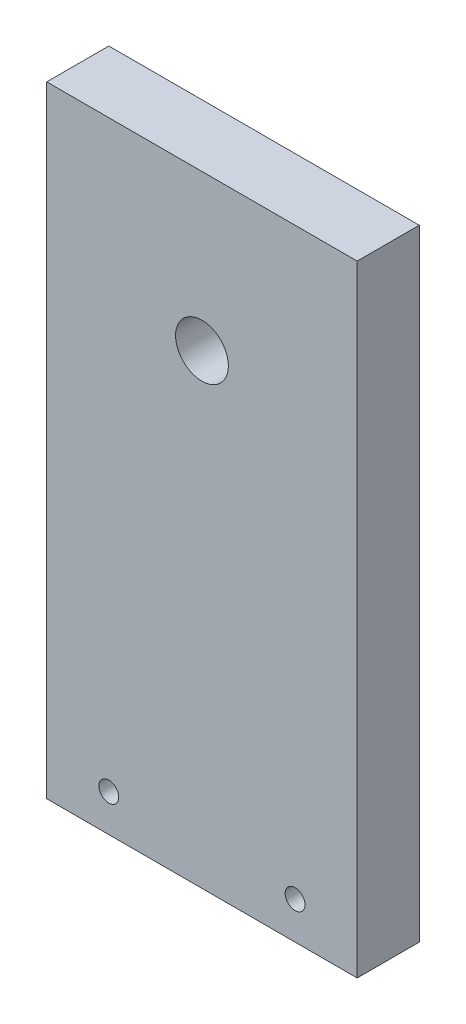
from build123d import *

# Parameters (mm, degrees)
SKETCH1_W           = 50
SKETCH1_H           = 100
BOSS_EXTRUDE1_DEPTH = 10
SKETCH2_R           = 4.25
SKETCH2_R_2         = 1.6
CUT_EXTRUDE2_DEPTH  = 11


with BuildPart() as part:
    # Sketch1 → Boss-Extrude1 (new body)
    with BuildSketch(Plane.XY):
        with Locations((0, 50)):
            Rectangle(SKETCH1_W, SKETCH1_H)
    extrude(amount=BOSS_EXTRUDE1_DEPTH)

    # Sketch2 → Cut-Extrude2 (cut)
    with BuildSketch(Plane.XY):
        with Locations(Location((0, 75, 0), (0, 0, 180))):
            Circle(SKETCH2_R)
        with Locations(Location((15, 6, 0), (0, 0, 180))):
            Circle(SKETCH2_R_2)
        with Locations(Location((-15, 6, 0), (0, 0, 180))):
            Circle(SKETCH2_R_2)
    extrude(amount=CUT_EXTRUDE2_DEPTH, mode=Mode.SUBTRACT)


solid = part.part
